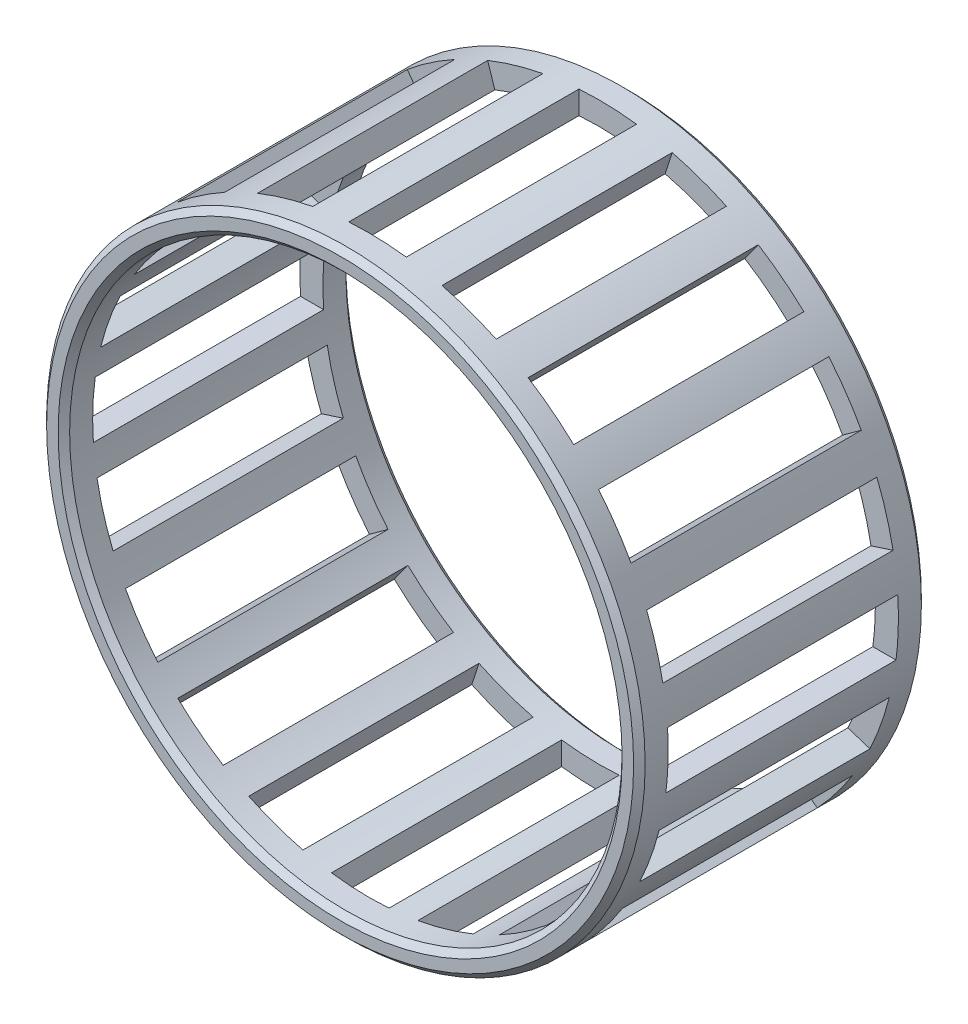
from build123d import *

# Parameters (mm, degrees)
ESQUISSE1_R                  = 26
ESQUISSE1_R_2                = 24
BASE_EXTRUSION_DEPTH         = 25
ENL_V_MAT_EXTRU_1_REACH      = 46.463
ESQUISSE2_W                  = 5
ESQUISSE2_H                  = 20
R_P_TITION_CIRCULAIRE2_COUNT = 20
CHANFREIN1_SIZE              = 0.5


with BuildPart() as part:
    # Esquisse1 → Base-Extrusion (new body)
    with BuildSketch(Plane.XY):
        Circle(ESQUISSE1_R)
        Circle(ESQUISSE1_R_2, mode=Mode.SUBTRACT)
    extrude(amount=BASE_EXTRUSION_DEPTH)

    # Esquisse2 → Enlèv. mat.-Extru.1 (cut, up to next)
    with BuildSketch(Plane(origin=(0, 0, 0), x_dir=(1, 0, 0), z_dir=(0, 1, 0)), mode=Mode.PRIVATE) as enl_v_mat_extru_1_sk1:
        with Locations((-0.75, -12.5)):
            Rectangle(ESQUISSE2_W, ESQUISSE2_H)
    enl_v_mat_extru_1_tool1 = extrude(enl_v_mat_extru_1_sk1.sketch, amount=-ENL_V_MAT_EXTRU_1_REACH, mode=Mode.PRIVATE) & part.part
    enl_v_mat_extru_1 = enl_v_mat_extru_1_tool1.solids().sort_by_distance((-0.75, 0, 12.5))[0]
    add(enl_v_mat_extru_1, mode=Mode.SUBTRACT)

    # Répétition circulaire2: Enlèv. mat.-Extru.1 ×20 about axis
    r_p_tition_circulaire2_axis = Axis((0, 0, 75), (0, 0, -1))
    for i in range(1, R_P_TITION_CIRCULAIRE2_COUNT):
        add(enl_v_mat_extru_1.rotate(r_p_tition_circulaire2_axis, i * 360 / R_P_TITION_CIRCULAIRE2_COUNT), mode=Mode.SUBTRACT)

    # Chanfrein1
    chanfrein1_edges = [part.edges().sort_by_distance(p)[0] for p in [
        (-26, 0, 25),
        (-26, 0, 0),
        (-24, 0, 25),
        (-24, 0, 0),
    ]]
    chamfer(chanfrein1_edges, length=CHANFREIN1_SIZE)


solid = part.part
